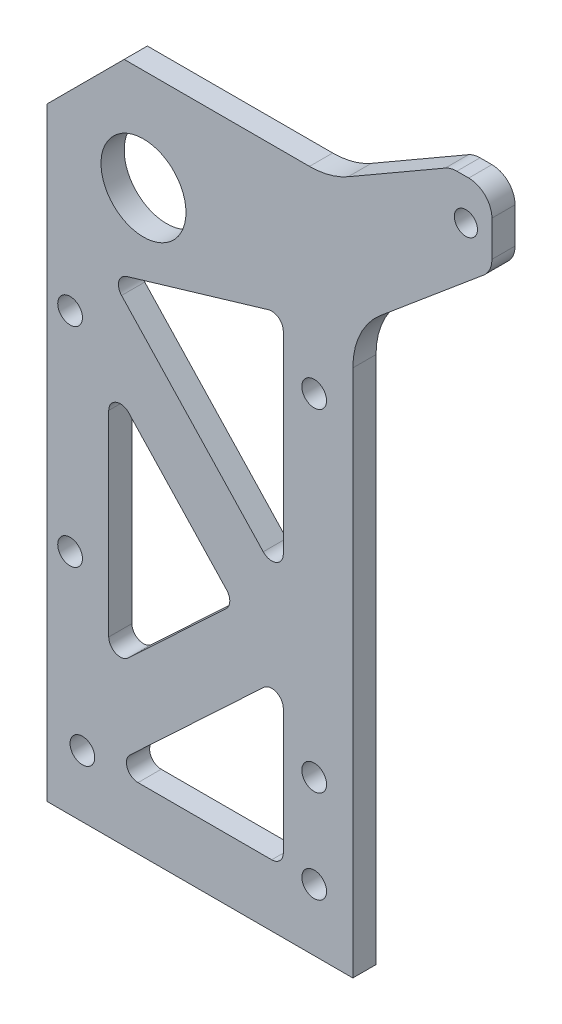
from build123d import *

# Parameters (mm, degrees)
SKETCH_1_R          = 1.6
SKETCH_1_R_2        = 6.075
EXTRUDE_1_DEPTH     = 3
SKETCH_6_R          = 6.075
SKETCH_6_R_2        = 5.5
EXTRUDE_3_DEPTH     = 3
CUT_EXTRUDE_3_DEPTH = 10
EXTRUDE_4_DEPTH     = 3
CUT_EXTRUDE_4_DEPTH = 10
EXTRUDE_5_DEPTH     = 3
SKETCH_11_R         = 1.5
CUT_EXTRUDE_5_DEPTH = 10
SKETCH1_W           = 13.017216885
SKETCH1_H           = 13.916417238
CUT_EXTRUDE1_DEPTH  = 2
CHAMFER1_SIZE       = 10
FILLET1_R           = 10
FILLET2_R           = 3


with BuildPart() as part:
    # 草图1 → 凸台-拉伸1 (new body)
    with BuildSketch(Plane.XY.offset(4)):
        Polygon((27.5, -75), (27.5, -38.070079149), (27.5, 15), (-12.093715748, 15), (-12.093715748, -75), align=None)
        with Locations(Location((22.5, -12, 0), (0, 0, 180))):
            Circle(SKETCH_1_R, mode=Mode.SUBTRACT)
        with Locations(Location((22.5, -55, 0), (0, 0, 180))):
            Circle(SKETCH_1_R, mode=Mode.SUBTRACT)
        with Locations(Location((22.5, -67, 0), (0, 0, 180))):
            Circle(SKETCH_1_R, mode=Mode.SUBTRACT)
        with Locations(Location((-7.5, -67, 0), (0, 0, 180))):
            Circle(SKETCH_1_R, mode=Mode.SUBTRACT)
        with Locations(Location((-9.093715748, -18.5, 0), (0, 0, 180))):
            Circle(SKETCH_1_R, mode=Mode.SUBTRACT)
        with Locations(Location((0.406284252, 0, 0), (0, 0, 180))):
            Circle(SKETCH_1_R_2, mode=Mode.SUBTRACT)
        with Locations(Location((-9.093715748, -45.5, 0), (0, 0, 180))):
            Circle(SKETCH_1_R, mode=Mode.SUBTRACT)
    extrude(amount=-EXTRUDE_1_DEPTH)

    # 草图6 → 凸台-拉伸3 (add)
    with BuildSketch(Plane.XY.offset(4)):
        with Locations((0.406284252, 0)):
            Circle(SKETCH_6_R)
        with Locations((0.406284252, 0)):
            Circle(SKETCH_6_R_2, mode=Mode.SUBTRACT)
    extrude(amount=-EXTRUDE_3_DEPTH)

    # 草图7 → 切除-拉伸3 (cut)
    with BuildSketch(Plane.XY.offset(4)):
        with BuildLine():
            Line((16.573520953, -5.561905559), (-1.763823971, -11))
            ThreePointArc((-1.763823971, -11), (-2.785101184, -12.045663796), (-2.431704924, -13.463948325))
            Line((-2.431704924, -13.463948325), (15.90564, -33.025853884))
            ThreePointArc((15.90564, -33.025853884), (17.551570485, -33.394908599), (18.5, -32))
            Line((18.5, -32), (18.5, -7))
            ThreePointArc((18.5, -7), (17.897296336, -5.797977003), (16.573520953, -5.561905559))
        make_face()
        with BuildLine():
            Line((-4.093715748, -27.181985619), (-4.093715748, -52.572589617))
            ThreePointArc((-4.093715748, -52.572589617), (-3.190045848, -53.948958177), (-1.567861865, -53.666949617))
            Line((-1.567861865, -53.666949617), (11.100960059, -41.791186455))
            ThreePointArc((11.100960059, -41.791186455), (11.57432379, -40.745267595), (11.169466175, -39.670972572))
            Line((11.169466175, -39.670972572), (-1.499355748, -26.156131735))
            ThreePointArc((-1.499355748, -26.156131735), (-3.145286233, -25.78707702), (-4.093715748, -27.181985619))
        make_face()
        with BuildLine():
            Line((15.974146116, -48.188371256), (-1.326105415, -64.40564))
            ThreePointArc((-1.326105415, -64.40564), (-1.69516013, -66.051570485), (-0.300251531, -67))
            Line((-0.300251531, -67), (17, -67))
            ThreePointArc((17, -67), (18.060660172, -66.560660172), (18.5, -65.5))
            Line((18.5, -65.5), (18.5, -49.282731256))
            ThreePointArc((18.5, -49.282731256), (17.596330099, -47.906362696), (15.974146116, -48.188371256))
        make_face()
    extrude(amount=-CUT_EXTRUDE_3_DEPTH, mode=Mode.SUBTRACT)

    # 草图8 → 凸台-拉伸4 (add)
    with BuildSketch(Plane.XY.offset(4)):
        Polygon((-12.093715748, 15), (15.09823702, 15), (27.5, 15), (27.5, 35), (15.09823702, 35), (-12.093715748, 35), align=None)
    extrude(amount=-EXTRUDE_4_DEPTH)

    # 草图9 → 切除-拉伸4 (cut)
    with BuildSketch(Plane.XY.offset(4)):
        Polygon((27.5, 13.166002361), (27.5, 35), (9.950271794, 35), (-3.087828752, 35), (-12.093715748, 35), (-12.093715748, 24.5099793), (-12.093715748, 13.166002361), align=None)
    extrude(amount=-CUT_EXTRUDE_4_DEPTH, mode=Mode.SUBTRACT)

    # 草图10 → 凸台-拉伸5 (add)
    with BuildSketch(Plane.XY.offset(4)):
        Polygon((27.5, 13.166002361), (27.5, 2.997829135), (27.5, -1.956571947), (47.5, 14.825420677), (47.5, 22.166002361), (40.159418315, 22.166002361), (24.570961047, 13.166002361), align=None)
    extrude(amount=-EXTRUDE_5_DEPTH)

    # 草图11 → 切除-拉伸5 (cut)
    with BuildSketch(Plane.XY.offset(4)):
        with Locations((42.134580189, 16.938478334)):
            Circle(SKETCH_11_R)
    extrude(amount=-CUT_EXTRUDE_5_DEPTH, mode=Mode.SUBTRACT)

    # Sketch1 → Cut-Extrude1 (cut)
    with BuildSketch(Plane(origin=(47.5, 0, 0), x_dir=(0, 0, -1), z_dir=(1, 0, 0))):
        with Locations((-1.715406072, 17.791444366)):
            Rectangle(SKETCH1_W, SKETCH1_H)
    extrude(amount=-CUT_EXTRUDE1_DEPTH, mode=Mode.SUBTRACT)

    # Chamfer1
    chamfer1_edges = [part.edges().sort_by_distance(p)[0] for p in [
        (-12.093715748, 13.166002361, 2.5),
    ]]
    chamfer(chamfer1_edges, length=CHAMFER1_SIZE)

    # Fillet1
    fillet1_edges = [part.edges().sort_by_distance(p)[0] for p in [
        (27.5, -1.956571947, 2.5),
        (24.570961047, 13.166002361, 2.5),
    ]]
    fillet(fillet1_edges, radius=FILLET1_R)

    # Fillet2
    fillet2_edges = [part.edges().sort_by_distance(p)[0] for p in [
        (40.159418315, 22.166002361, 2.5),
        (45.5, 13.147221414, 2.5),
        (45.5, 22.166002361, 2.5),
    ]]
    fillet(fillet2_edges, radius=FILLET2_R)


solid = part.part
